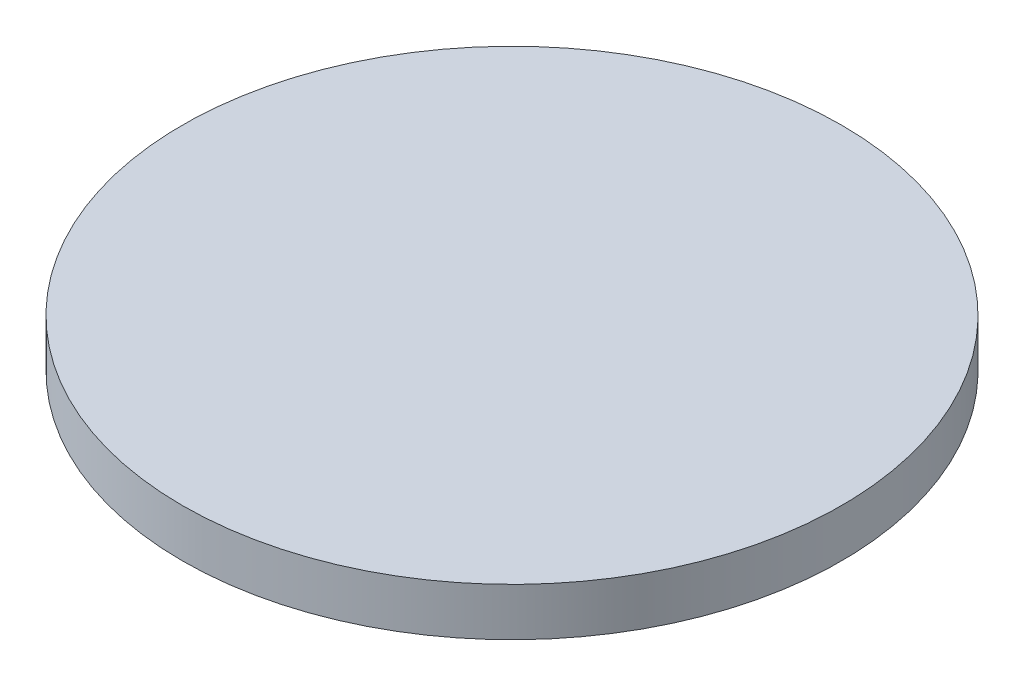
from build123d import *

# Parameters (mm, degrees)
SKETCH1_R           = 13.97
BOSS_EXTRUDE1_DEPTH = 2.032


with BuildPart() as part:
    # Sketch1 → Boss-Extrude1 (new body)
    with BuildSketch(Plane(origin=(0, 0, 0), x_dir=(1, 0, 0), z_dir=(0, 1, 0))):
        with Locations(Location((0, 0, 0), (0, 0, 270))):
            Circle(SKETCH1_R)
    extrude(amount=BOSS_EXTRUDE1_DEPTH)


solid = part.part
